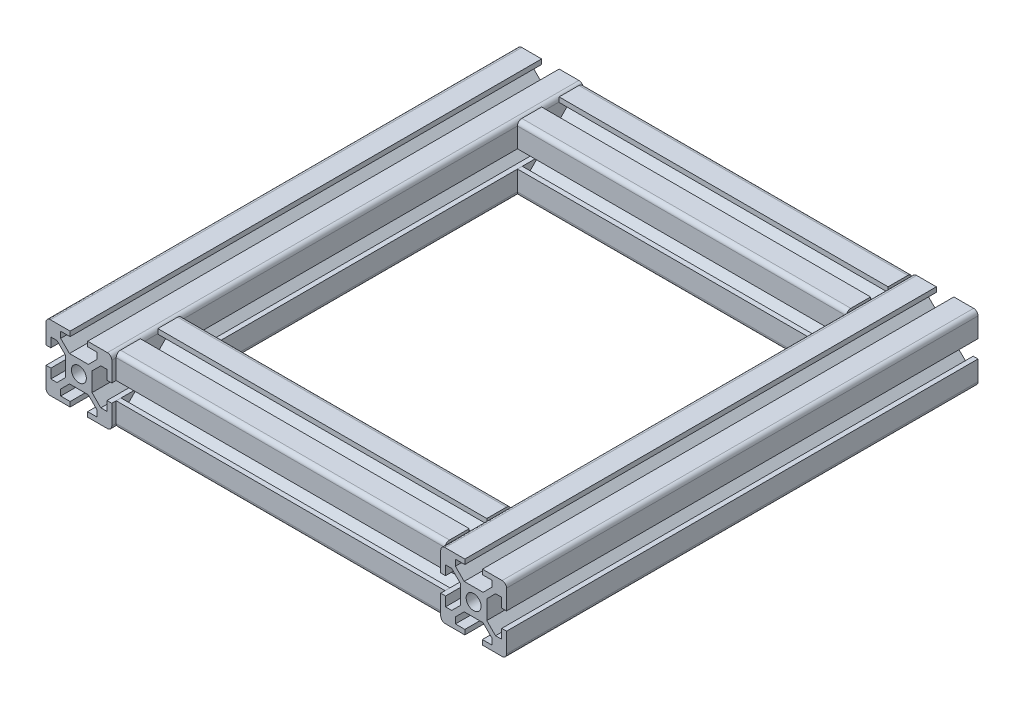
from build123d import *

# Parameters (mm, degrees)
SKETCH1_R                          = 3.4
ALUMINIUM_EXTRUSION_3030_1_DEPTH   = 215
SKETCH1_ON_SEGMENT_2_R             = 3.4
ALUMINIUM_EXTRUSION_3030_1_2_DEPTH = 215
SKETCH1_ON_SEGMENT_3_R             = 3.4
ALUMINIUM_EXTRUSION_3030_1_3_DEPTH = 182
SKETCH1_ON_SEGMENT_4_R             = 3.4
ALUMINIUM_EXTRUSION_3030_1_4_DEPTH = 182


with BuildPart() as part:
    # Sketch1 → Aluminium extrusion 3030(1) (new body)
    with BuildSketch(Plane(origin=(-90, 0, 17), x_dir=(1, 0, 0), z_dir=(0, 0, -1))):
        with BuildLine():
            Line((0, 6), (-4.302943725, 6))
            Line((-4.302943725, 6), (-8.3, 9.997056275))
            Line((-8.3, 9.997056275), (-8.3, 12.8))
            Line((-8.3, 12.8), (-4, 12.8))
            Line((-4, 12.8), (-4, 15))
            Line((-4, 15), (-13, 15))
            ThreePointArc((-13, 15), (-14.414213562, 14.414213562), (-15, 13))
            Line((-15, 13), (-15, 4))
            Line((-15, 4), (-12.8, 4))
            Line((-12.8, 4), (-12.8, 8.3))
            Line((-12.8, 8.3), (-9.997056275, 8.3))
            Line((-9.997056275, 8.3), (-6, 4.302943725))
            Line((-6, 4.302943725), (-6, 0))
            Line((-6, 0), (-6, -4.302943725))
            Line((-6, -4.302943725), (-9.997056275, -8.3))
            Line((-9.997056275, -8.3), (-12.8, -8.3))
            Line((-12.8, -8.3), (-12.8, -4))
            Line((-12.8, -4), (-15, -4))
            Line((-15, -4), (-15, -13))
            ThreePointArc((-15, -13), (-14.414213562, -14.414213562), (-13, -15))
            Line((-13, -15), (-4, -15))
            Line((-4, -15), (-4, -12.8))
            Line((-4, -12.8), (-8.3, -12.8))
            Line((-8.3, -12.8), (-8.3, -9.997056275))
            Line((-8.3, -9.997056275), (-4.302943725, -6))
            Line((-4.302943725, -6), (0, -6))
            Line((0, -6), (4.302943725, -6))
            Line((4.302943725, -6), (8.3, -9.997056275))
            Line((8.3, -9.997056275), (8.3, -12.8))
            Line((8.3, -12.8), (4, -12.8))
            Line((4, -12.8), (4, -15))
            Line((4, -15), (13, -15))
            ThreePointArc((13, -15), (14.414213562, -14.414213562), (15, -13))
            Line((15, -13), (15, -4))
            Line((15, -4), (12.8, -4))
            Line((12.8, -4), (12.8, -8.3))
            Line((12.8, -8.3), (9.997056275, -8.3))
            Line((9.997056275, -8.3), (6, -4.302943725))
            Line((6, -4.302943725), (6, 0))
            Line((6, 0), (6, 4.302943725))
            Line((6, 4.302943725), (9.997056275, 8.3))
            Line((9.997056275, 8.3), (12.8, 8.3))
            Line((12.8, 8.3), (12.8, 4))
            Line((12.8, 4), (15, 4))
            Line((15, 4), (15, 13))
            ThreePointArc((15, 13), (14.414213562, 14.414213562), (13, 15))
            Line((13, 15), (4, 15))
            Line((4, 15), (4, 12.8))
            Line((4, 12.8), (8.3, 12.8))
            Line((8.3, 12.8), (8.3, 9.997056275))
            Line((8.3, 9.997056275), (4.302943725, 6))
            Line((4.302943725, 6), (0, 6))
        make_face()
        Circle(SKETCH1_R, mode=Mode.SUBTRACT)
    extrude(amount=ALUMINIUM_EXTRUSION_3030_1_DEPTH)


with BuildPart() as body_2:
    # Sketch1 on segment 2 (carried to segment 2) → Aluminium extrusion 3030_1 2 (new body)
    with BuildSketch(Plane(origin=(90, 0, 17), x_dir=(1, 0, 0), z_dir=(0, 0, -1))):
        with BuildLine():
            Line((0, 6), (-4.302943725, 6))
            Line((-4.302943725, 6), (-8.3, 9.997056275))
            Line((-8.3, 9.997056275), (-8.3, 12.8))
            Line((-8.3, 12.8), (-4, 12.8))
            Line((-4, 12.8), (-4, 15))
            Line((-4, 15), (-13, 15))
            ThreePointArc((-13, 15), (-14.414213562, 14.414213562), (-15, 13))
            Line((-15, 13), (-15, 4))
            Line((-15, 4), (-12.8, 4))
            Line((-12.8, 4), (-12.8, 8.3))
            Line((-12.8, 8.3), (-9.997056275, 8.3))
            Line((-9.997056275, 8.3), (-6, 4.302943725))
            Line((-6, 4.302943725), (-6, 0))
            Line((-6, 0), (-6, -4.302943725))
            Line((-6, -4.302943725), (-9.997056275, -8.3))
            Line((-9.997056275, -8.3), (-12.8, -8.3))
            Line((-12.8, -8.3), (-12.8, -4))
            Line((-12.8, -4), (-15, -4))
            Line((-15, -4), (-15, -13))
            ThreePointArc((-15, -13), (-14.414213562, -14.414213562), (-13, -15))
            Line((-13, -15), (-4, -15))
            Line((-4, -15), (-4, -12.8))
            Line((-4, -12.8), (-8.3, -12.8))
            Line((-8.3, -12.8), (-8.3, -9.997056275))
            Line((-8.3, -9.997056275), (-4.302943725, -6))
            Line((-4.302943725, -6), (0, -6))
            Line((0, -6), (4.302943725, -6))
            Line((4.302943725, -6), (8.3, -9.997056275))
            Line((8.3, -9.997056275), (8.3, -12.8))
            Line((8.3, -12.8), (4, -12.8))
            Line((4, -12.8), (4, -15))
            Line((4, -15), (13, -15))
            ThreePointArc((13, -15), (14.414213562, -14.414213562), (15, -13))
            Line((15, -13), (15, -4))
            Line((15, -4), (12.8, -4))
            Line((12.8, -4), (12.8, -8.3))
            Line((12.8, -8.3), (9.997056275, -8.3))
            Line((9.997056275, -8.3), (6, -4.302943725))
            Line((6, -4.302943725), (6, 0))
            Line((6, 0), (6, 4.302943725))
            Line((6, 4.302943725), (9.997056275, 8.3))
            Line((9.997056275, 8.3), (12.8, 8.3))
            Line((12.8, 8.3), (12.8, 4))
            Line((12.8, 4), (15, 4))
            Line((15, 4), (15, 13))
            ThreePointArc((15, 13), (14.414213562, 14.414213562), (13, 15))
            Line((13, 15), (4, 15))
            Line((4, 15), (4, 12.8))
            Line((4, 12.8), (8.3, 12.8))
            Line((8.3, 12.8), (8.3, 9.997056275))
            Line((8.3, 9.997056275), (4.302943725, 6))
            Line((4.302943725, 6), (0, 6))
        make_face()
        Circle(SKETCH1_ON_SEGMENT_2_R, mode=Mode.SUBTRACT)
    extrude(amount=ALUMINIUM_EXTRUSION_3030_1_2_DEPTH)


with BuildPart() as body_3:
    # Sketch1 on segment 3 (carried to segment 3) → Aluminium extrusion 3030_1 3 (new body)
    with BuildSketch(Plane(origin=(91, 0, 0), x_dir=(0, 0, -1), z_dir=(-1, 0, 0))):
        with BuildLine():
            Line((0, 6), (-4.302943725, 6))
            Line((-4.302943725, 6), (-8.3, 9.997056275))
            Line((-8.3, 9.997056275), (-8.3, 12.8))
            Line((-8.3, 12.8), (-4, 12.8))
            Line((-4, 12.8), (-4, 15))
            Line((-4, 15), (-13, 15))
            ThreePointArc((-13, 15), (-14.414213562, 14.414213562), (-15, 13))
            Line((-15, 13), (-15, 4))
            Line((-15, 4), (-12.8, 4))
            Line((-12.8, 4), (-12.8, 8.3))
            Line((-12.8, 8.3), (-9.997056275, 8.3))
            Line((-9.997056275, 8.3), (-6, 4.302943725))
            Line((-6, 4.302943725), (-6, 0))
            Line((-6, 0), (-6, -4.302943725))
            Line((-6, -4.302943725), (-9.997056275, -8.3))
            Line((-9.997056275, -8.3), (-12.8, -8.3))
            Line((-12.8, -8.3), (-12.8, -4))
            Line((-12.8, -4), (-15, -4))
            Line((-15, -4), (-15, -13))
            ThreePointArc((-15, -13), (-14.414213562, -14.414213562), (-13, -15))
            Line((-13, -15), (-4, -15))
            Line((-4, -15), (-4, -12.8))
            Line((-4, -12.8), (-8.3, -12.8))
            Line((-8.3, -12.8), (-8.3, -9.997056275))
            Line((-8.3, -9.997056275), (-4.302943725, -6))
            Line((-4.302943725, -6), (0, -6))
            Line((0, -6), (4.302943725, -6))
            Line((4.302943725, -6), (8.3, -9.997056275))
            Line((8.3, -9.997056275), (8.3, -12.8))
            Line((8.3, -12.8), (4, -12.8))
            Line((4, -12.8), (4, -15))
            Line((4, -15), (13, -15))
            ThreePointArc((13, -15), (14.414213562, -14.414213562), (15, -13))
            Line((15, -13), (15, -4))
            Line((15, -4), (12.8, -4))
            Line((12.8, -4), (12.8, -8.3))
            Line((12.8, -8.3), (9.997056275, -8.3))
            Line((9.997056275, -8.3), (6, -4.302943725))
            Line((6, -4.302943725), (6, 0))
            Line((6, 0), (6, 4.302943725))
            Line((6, 4.302943725), (9.997056275, 8.3))
            Line((9.997056275, 8.3), (12.8, 8.3))
            Line((12.8, 8.3), (12.8, 4))
            Line((12.8, 4), (15, 4))
            Line((15, 4), (15, 13))
            ThreePointArc((15, 13), (14.414213562, 14.414213562), (13, 15))
            Line((13, 15), (4, 15))
            Line((4, 15), (4, 12.8))
            Line((4, 12.8), (8.3, 12.8))
            Line((8.3, 12.8), (8.3, 9.997056275))
            Line((8.3, 9.997056275), (4.302943725, 6))
            Line((4.302943725, 6), (0, 6))
        make_face()
        Circle(SKETCH1_ON_SEGMENT_3_R, mode=Mode.SUBTRACT)
    extrude(amount=ALUMINIUM_EXTRUSION_3030_1_3_DEPTH)

    # Aluminium extrusion 3030_1 3 end butt 1
    split(bisect_by=Plane(origin=(75, 0, 0), x_dir=(0, -1, 0), z_dir=(-1, 0, 0)), keep=Keep.TOP)

    # Aluminium extrusion 3030_1 3 end butt 2
    split(bisect_by=Plane.YZ.offset(-75), keep=Keep.TOP)


with BuildPart() as body_4:
    # Sketch1 on segment 4 (carried to segment 4) → Aluminium extrusion 3030_1 4 (new body)
    with BuildSketch(Plane(origin=(-91, 0, -183), x_dir=(0, 0, 1), z_dir=(1, 0, 0))):
        with BuildLine():
            Line((0, 6), (-4.302943725, 6))
            Line((-4.302943725, 6), (-8.3, 9.997056275))
            Line((-8.3, 9.997056275), (-8.3, 12.8))
            Line((-8.3, 12.8), (-4, 12.8))
            Line((-4, 12.8), (-4, 15))
            Line((-4, 15), (-13, 15))
            ThreePointArc((-13, 15), (-14.414213562, 14.414213562), (-15, 13))
            Line((-15, 13), (-15, 4))
            Line((-15, 4), (-12.8, 4))
            Line((-12.8, 4), (-12.8, 8.3))
            Line((-12.8, 8.3), (-9.997056275, 8.3))
            Line((-9.997056275, 8.3), (-6, 4.302943725))
            Line((-6, 4.302943725), (-6, 0))
            Line((-6, 0), (-6, -4.302943725))
            Line((-6, -4.302943725), (-9.997056275, -8.3))
            Line((-9.997056275, -8.3), (-12.8, -8.3))
            Line((-12.8, -8.3), (-12.8, -4))
            Line((-12.8, -4), (-15, -4))
            Line((-15, -4), (-15, -13))
            ThreePointArc((-15, -13), (-14.414213562, -14.414213562), (-13, -15))
            Line((-13, -15), (-4, -15))
            Line((-4, -15), (-4, -12.8))
            Line((-4, -12.8), (-8.3, -12.8))
            Line((-8.3, -12.8), (-8.3, -9.997056275))
            Line((-8.3, -9.997056275), (-4.302943725, -6))
            Line((-4.302943725, -6), (0, -6))
            Line((0, -6), (4.302943725, -6))
            Line((4.302943725, -6), (8.3, -9.997056275))
            Line((8.3, -9.997056275), (8.3, -12.8))
            Line((8.3, -12.8), (4, -12.8))
            Line((4, -12.8), (4, -15))
            Line((4, -15), (13, -15))
            ThreePointArc((13, -15), (14.414213562, -14.414213562), (15, -13))
            Line((15, -13), (15, -4))
            Line((15, -4), (12.8, -4))
            Line((12.8, -4), (12.8, -8.3))
            Line((12.8, -8.3), (9.997056275, -8.3))
            Line((9.997056275, -8.3), (6, -4.302943725))
            Line((6, -4.302943725), (6, 0))
            Line((6, 0), (6, 4.302943725))
            Line((6, 4.302943725), (9.997056275, 8.3))
            Line((9.997056275, 8.3), (12.8, 8.3))
            Line((12.8, 8.3), (12.8, 4))
            Line((12.8, 4), (15, 4))
            Line((15, 4), (15, 13))
            ThreePointArc((15, 13), (14.414213562, 14.414213562), (13, 15))
            Line((13, 15), (4, 15))
            Line((4, 15), (4, 12.8))
            Line((4, 12.8), (8.3, 12.8))
            Line((8.3, 12.8), (8.3, 9.997056275))
            Line((8.3, 9.997056275), (4.302943725, 6))
            Line((4.302943725, 6), (0, 6))
        make_face()
        Circle(SKETCH1_ON_SEGMENT_4_R, mode=Mode.SUBTRACT)
    extrude(amount=ALUMINIUM_EXTRUSION_3030_1_4_DEPTH)

    # Aluminium extrusion 3030_1 4 end butt 1
    split(bisect_by=Plane(origin=(-75, 0, -183), x_dir=(0, 1, 0), z_dir=(1, 0, 0)), keep=Keep.TOP)

    # Aluminium extrusion 3030_1 4 end butt 2
    split(bisect_by=Plane(origin=(75, 0, -183), x_dir=(0, -1, 0), z_dir=(-1, 0, 0)), keep=Keep.TOP)


solid = Compound([part.part, body_2.part, body_3.part, body_4.part])
